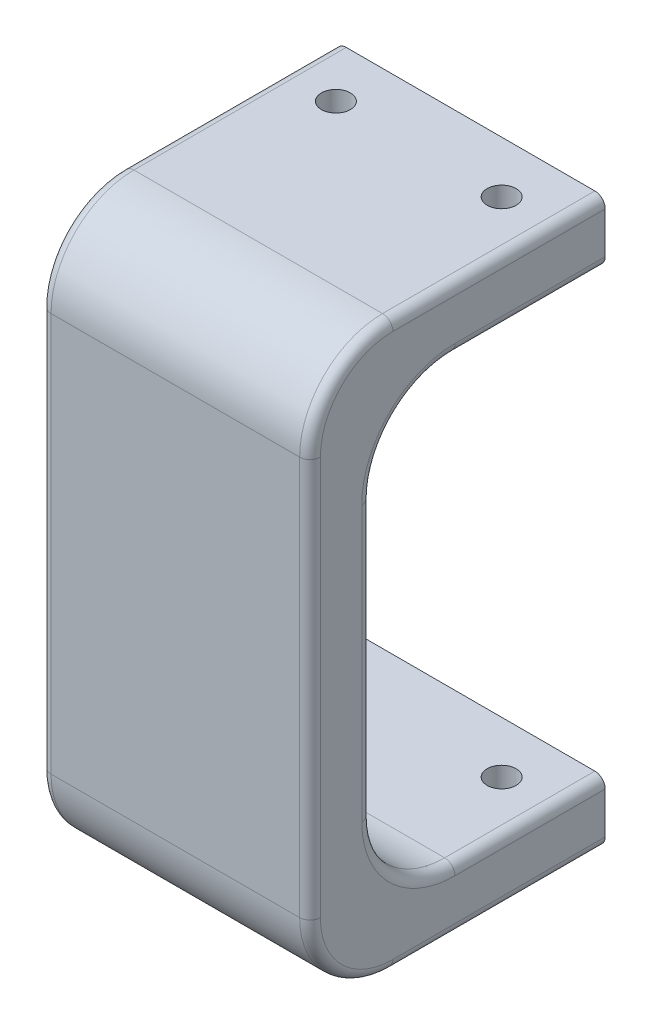
from build123d import *

# Parameters (mm, degrees)
BASE_DEPTH              = 13
SKETCH2_R               = 1.4
SCREW_HOLES_DEPTH       = 63.860957676
F_8MM_BRACKET_FILLETS_R = 8
F_1MM_EDGE_FILLETS_R    = 1


with BuildPart() as part:
    # Sketch1 → Base (new, symmetric)
    with BuildSketch(Plane(origin=(0, 0, 0), x_dir=(0, 0, -1), z_dir=(1, 0, 0))):
        Polygon((0, 27.25), (0, 21.25), (-22.5, 21.25), (-22.5, -21.25), (0, -21.25), (0, -27.25), (-28.5, -27.25), (-28.5, 27.25), align=None)
    extrude(amount=BASE_DEPTH, both=True)

    # Sketch2 → Screw Holes (cut, through all)
    with BuildSketch(Plane(origin=(0, 27.25, 0), x_dir=(1, 0, 0), z_dir=(0, 1, 0))):
        with Locations((-8, -5)):
            Circle(SKETCH2_R)
        with Locations((8, -5)):
            Circle(SKETCH2_R)
    extrude(amount=-SCREW_HOLES_DEPTH, mode=Mode.SUBTRACT)

    # 8mm Bracket Fillets
    f_8mm_bracket_fillets_edges = [part.edges().sort_by_distance(p)[0] for p in [
        (0, 21.25, 22.5),
        (0, 27.25, 28.5),
        (0, -27.25, 28.5),
        (0, -21.25, 22.5),
    ]]
    fillet(f_8mm_bracket_fillets_edges, radius=F_8MM_BRACKET_FILLETS_R)

    # 1mm Edge Fillets
    f_1mm_edge_fillets_edges = [part.edges().sort_by_distance(p)[0] for p in [
        (13, -21.25, 7.25),
        (13, 21.25, 7.25),
        (13, 18.906854249, 20.156854249),
        (13, 0, 22.5),
        (-13, -21.25, 7.25),
        (-13, -18.906854249, 20.156854249),
        (-13, 21.25, 7.25),
        (-13, 18.906854249, 20.156854249),
        (-13, 27.25, 10.25),
        (-13, 24.906854249, 26.156854249),
        (-13, -27.25, 10.25),
        (-13, -24.906854249, 26.156854249),
        (13, 27.25, 10.25),
        (13, 24.906854249, 26.156854249),
        (13, -27.25, 10.25),
        (13, -24.906854249, 26.156854249),
        (13, -18.906854249, 20.156854249),
        (-13, 0, 22.5),
        (-13, 0, 28.5),
        (13, 0, 28.5),
    ]]
    fillet(f_1mm_edge_fillets_edges, radius=F_1MM_EDGE_FILLETS_R)


solid = part.part
